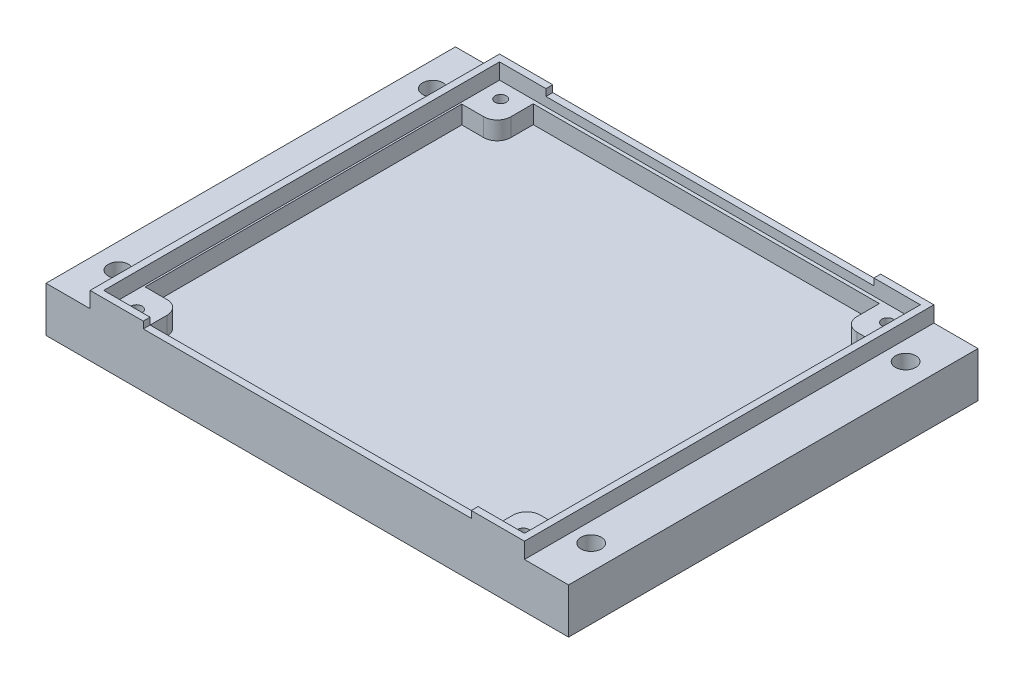
from build123d import *

# Parameters (mm, degrees)
SKETCH1_W           = 115.5
SKETCH1_H           = 90.5
BOSS_EXTRUDE1_DEPTH = 10
SKETCH2_W           = 96
SKETCH2_H           = 90.5
SKETCH2_W_2         = 93
SKETCH2_H_2         = 87.5
BOSS_EXTRUDE2_DEPTH = 3.5
SKETCH3_R           = 1.25
CUT_EXTRUDE1_DEPTH  = 20
CUT_EXTRUDE2_DEPTH  = 4
FILLET1_R           = 3
SKETCH5_R           = 2.25
CUT_EXTRUDE3_DEPTH  = 15
SKETCH6_W           = 72.5
SKETCH6_H           = 10.501850212
CUT_EXTRUDE4_DEPTH  = 98


with BuildPart() as part:
    # Sketch1 → Boss-Extrude1 (new body)
    with BuildSketch(Plane(origin=(0, 0, 0), x_dir=(1, 0, 0), z_dir=(0, 1, 0))):
        Rectangle(SKETCH1_W, SKETCH1_H)
    extrude(amount=BOSS_EXTRUDE1_DEPTH)

    # Sketch2 → Boss-Extrude2 (add)
    with BuildSketch(Plane(origin=(0, 10, 0), x_dir=(1, 0, 0), z_dir=(0, 1, 0))):
        Rectangle(SKETCH2_W, SKETCH2_H)
        Rectangle(SKETCH2_W_2, SKETCH2_H_2, mode=Mode.SUBTRACT)
    extrude(amount=BOSS_EXTRUDE2_DEPTH)

    # Sketch3 → Cut-Extrude1 (cut)
    with BuildSketch(Plane(origin=(0, 10, 0), x_dir=(1, 0, 0), z_dir=(0, 1, 0))):
        with Locations(Location((-42.75, 40.25, 0), (0, 0, 270))):
            Circle(SKETCH3_R)
        with Locations(Location((42.75, 40.25, 0), (0, 0, 270))):
            Circle(SKETCH3_R)
        with Locations(Location((42.75, -40.25, 0), (0, 0, 270))):
            Circle(SKETCH3_R)
        with Locations(Location((-42.75, -40.25, 0), (0, 0, 270))):
            Circle(SKETCH3_R)
    extrude(amount=-CUT_EXTRUDE1_DEPTH, mode=Mode.SUBTRACT)

    # Sketch4 → Cut-Extrude2 (cut)
    with BuildSketch(Plane(origin=(0, 10, 0), x_dir=(1, 0, 0), z_dir=(0, 1, 0))):
        Polygon((-38.25, 42.95), (38.25, 42.95), (38.25, 35), (46.1, 35), (46.1, -35), (38.25, -35), (38.25, -42.95), (-38.25, -42.95), (-38.25, -35), (-46.1, -35), (-46.1, 35), (-38.25, 35), align=None)
    extrude(amount=-CUT_EXTRUDE2_DEPTH, mode=Mode.SUBTRACT)

    # Fillet1
    fillet1_edges = [part.edges().sort_by_distance(p)[0] for p in [
        (-38.25, 8, -35),
        (38.25, 8, -35),
        (38.25, 8, 35),
        (-38.25, 8, 35),
    ]]
    fillet(fillet1_edges, radius=FILLET1_R)

    # Sketch5 → Cut-Extrude3 (cut)
    with BuildSketch(Plane(origin=(0, 10, 0), x_dir=(1, 0, 0), z_dir=(0, 1, 0))):
        with Locations(Location((-52.25, 34.75, 0), (0, 0, 270))):
            Circle(SKETCH5_R)
        with Locations(Location((52.25, 34.75, 0), (0, 0, 270))):
            Circle(SKETCH5_R)
        with Locations(Location((52.25, -34.75, 0), (0, 0, 270))):
            Circle(SKETCH5_R)
        with Locations(Location((-52.25, -34.75, 0), (0, 0, 270))):
            Circle(SKETCH5_R)
    extrude(amount=-CUT_EXTRUDE3_DEPTH, mode=Mode.SUBTRACT)

    # Sketch6 → Cut-Extrude4 (cut)
    with BuildSketch(Plane.XY.offset(45.25)):
        with Locations((0, 17.250925106)):
            Rectangle(SKETCH6_W, SKETCH6_H)
    extrude(amount=-CUT_EXTRUDE4_DEPTH, mode=Mode.SUBTRACT)


solid = part.part
